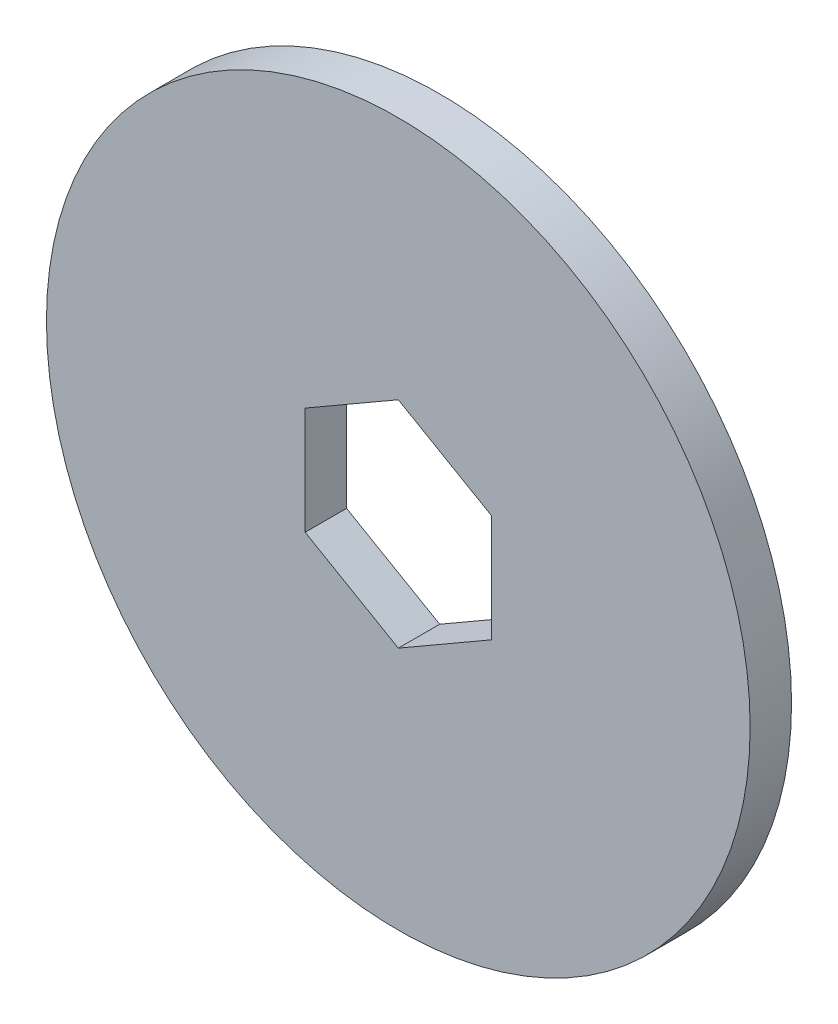
from build123d import *

# Parameters (mm, degrees)
MODEL_R             = 25
BOSS_EXTRUDE1_DEPTH = 6
BOSS_EXTRUDE2_START = -6
SKETCH2_R           = 51
SKETCH2_R_2         = 25
BOSS_EXTRUDE2_DEPTH = 6


with BuildPart() as part:
    # Model → Boss-Extrude1 (new body)
    with BuildSketch(Plane.XY):
        with Locations((642.3, -192)):
            Circle(MODEL_R)
        Polygon((628.8, -184.205771366), (628.8, -199.794228634), (642.3, -207.588457268), (655.8, -199.794228634), (655.8, -184.205771366), (642.3, -176.411542732), align=None, mode=Mode.SUBTRACT)
    extrude(amount=BOSS_EXTRUDE1_DEPTH)

    # Sketch2 → Boss-Extrude2 (add)
    with BuildSketch(Plane.XY.offset(6).offset(BOSS_EXTRUDE2_START)):
        with Locations((642.3, -192)):
            Circle(SKETCH2_R)
        with Locations((642.3, -192)):
            Circle(SKETCH2_R_2, mode=Mode.SUBTRACT)
    extrude(amount=BOSS_EXTRUDE2_DEPTH)


solid = part.part
